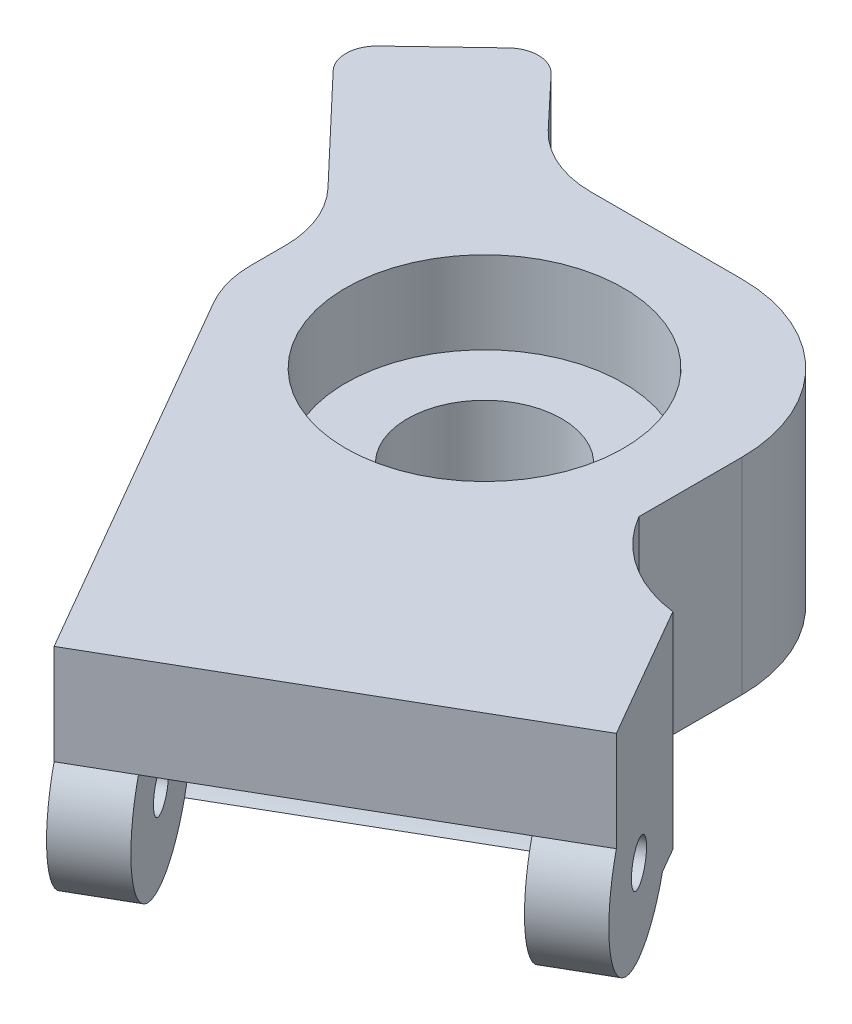
from build123d import *

# Parameters (mm, degrees)
SKETCH1_R           = 13.5
BOSS_EXTRUDE1_DEPTH = 8
BOSS_EXTRUDE3_START = 12
SKETCH7_R           = 7.5
BOSS_EXTRUDE3_DEPTH = 12
SKETCH4_W           = 28
SKETCH4_H           = 10
CUT_EXTRUDE2_DEPTH  = 12
SKETCH5_R           = 2
CUT_EXTRUDE3_DEPTH  = 100
SKETCH9_R           = 8
SKETCH9_R_2         = 2
BOSS_EXTRUDE4_DEPTH = 40
FILLET2_R           = 10
FILLET3_R           = 3
SKETCH11_R          = 8
CUT_EXTRUDE6_DEPTH  = 14


with BuildPart() as part:
    # Sketch1 → Boss-Extrude1 (new body)
    with BuildSketch(Plane(origin=(0, 0, 0), x_dir=(1, 0, 0), z_dir=(0, 1, 0))):
        with BuildLine():
            Line((2.5, -44.330127019), (37.141016151, -24.330127019))
            Line((37.141016151, -24.330127019), (29.641016151, -11.339745962))
            ThreePointArc((29.641016151, -11.339745962), (24.078586932, -9.298131712), (20, -5))
            Line((20, -5), (20, 5))
            ThreePointArc((20, 5), (15.606601718, 15.606601718), (5, 20))
            Line((5, 20), (-14, 20))
            Line((-14, 20), (-23.593165935, 30.196625292))
            Line((-23.593165935, 30.196625292), (-34.466370956, 19.863503181))
            Line((-34.466370956, 19.863503181), (-20, 4.641016151))
            Line((-20, 4.641016151), (-20, -5.358983849))
            Line((-20, -5.358983849), (2.5, -44.330127019))
        make_face()
        with Locations(Location((0, 0, 0), (0, 0, 270))):
            Circle(SKETCH1_R, mode=Mode.SUBTRACT)
    extrude(amount=BOSS_EXTRUDE1_DEPTH)

    # Sketch7 → Boss-Extrude3 (add)
    with BuildSketch(Plane.XZ.offset(BOSS_EXTRUDE3_START)):
        with BuildLine():
            Line((20, 5), (20, -5))
            ThreePointArc((20, -5), (15.606601718, -15.606601718), (5, -20))
            Line((5, -20), (-14, -20))
            Line((-14, -20), (-23.593165935, -30.196625292))
            Line((-23.593165935, -30.196625292), (-34.466370956, -19.863503181))
            Line((-34.466370956, -19.863503181), (-20, -4.641016151))
            Line((-20, -4.641016151), (-20, 5.358983849))
            Line((-20, 5.358983849), (2.5, 44.330127019))
            Line((2.5, 44.330127019), (37.141016151, 24.330127019))
            Line((37.141016151, 24.330127019), (29.641016151, 11.339745962))
            ThreePointArc((29.641016151, 11.339745962), (24.078586932, 9.298131712), (20, 5))
        make_face()
        with Locations(Location((0, 0, 0), (0, 0, 270))):
            Circle(SKETCH7_R, mode=Mode.SUBTRACT)
    extrude(amount=-BOSS_EXTRUDE3_DEPTH)

    # Sketch4 → Cut-Extrude2 (cut)
    with BuildSketch(Plane(origin=(19.820508076, 0, 34.330127019), x_dir=(0.8660254037844378, 0, -0.5000000000000016), z_dir=(0.5000000000000014, 0, 0.8660254037844377))):
        with Locations((0, -7)):
            Rectangle(SKETCH4_W, SKETCH4_H)
    extrude(amount=-CUT_EXTRUDE2_DEPTH, mode=Mode.SUBTRACT)

    # Sketch5 → Cut-Extrude3 (cut)
    with BuildSketch(Plane(origin=(17.320508076, 0, -10), x_dir=(-0.5000000000000026, 0, -0.8660254037844373), z_dir=(0.8660254037844373, 0, -0.5000000000000026))):
        with Locations((-33.641016151, -7)):
            Circle(SKETCH5_R)
    extrude(amount=-CUT_EXTRUDE3_DEPTH, mode=Mode.SUBTRACT)

    # Sketch9 → Boss-Extrude4 (add)
    with BuildSketch(Plane(origin=(17.320508076, 0, -10), x_dir=(-0.5000000000000017, 0, -0.8660254037844378), z_dir=(0.8660254037844377, 0, -0.5000000000000016))):
        with Locations((-33.641016151, -7)):
            Circle(SKETCH9_R)
        with Locations((-33.641016151, -7)):
            Circle(SKETCH9_R_2, mode=Mode.SUBTRACT)
    extrude(amount=-BOSS_EXTRUDE4_DEPTH)

    # Fillet2
    fillet2_edges = [part.edges().sort_by_distance(p)[0] for p in [
        (-20, -2, 5.358983849),
        (-20, -2, -4.641016151),
        (-14, -2, -20),
    ]]
    fillet(fillet2_edges, radius=FILLET2_R)

    # Fillet3
    fillet3_edges = [part.edges().sort_by_distance(p)[0] for p in [
        (-34.466370956, -2, -19.863503181),
        (-23.593165935, -2, -30.196625292),
    ]]
    fillet(fillet3_edges, radius=FILLET3_R)

    # Sketch11 → Cut-Extrude6 (cut, symmetric)
    with BuildSketch(Plane(origin=(0, 0, 0), x_dir=(-0.5000000000000017, 0, -0.8660254037844378), z_dir=(0.8660254037844377, 0, -0.5000000000000016))):
        with Locations((-33.641016151, -7)):
            Circle(SKETCH11_R)
    extrude(amount=CUT_EXTRUDE6_DEPTH, both=True, mode=Mode.SUBTRACT)


solid = part.part
